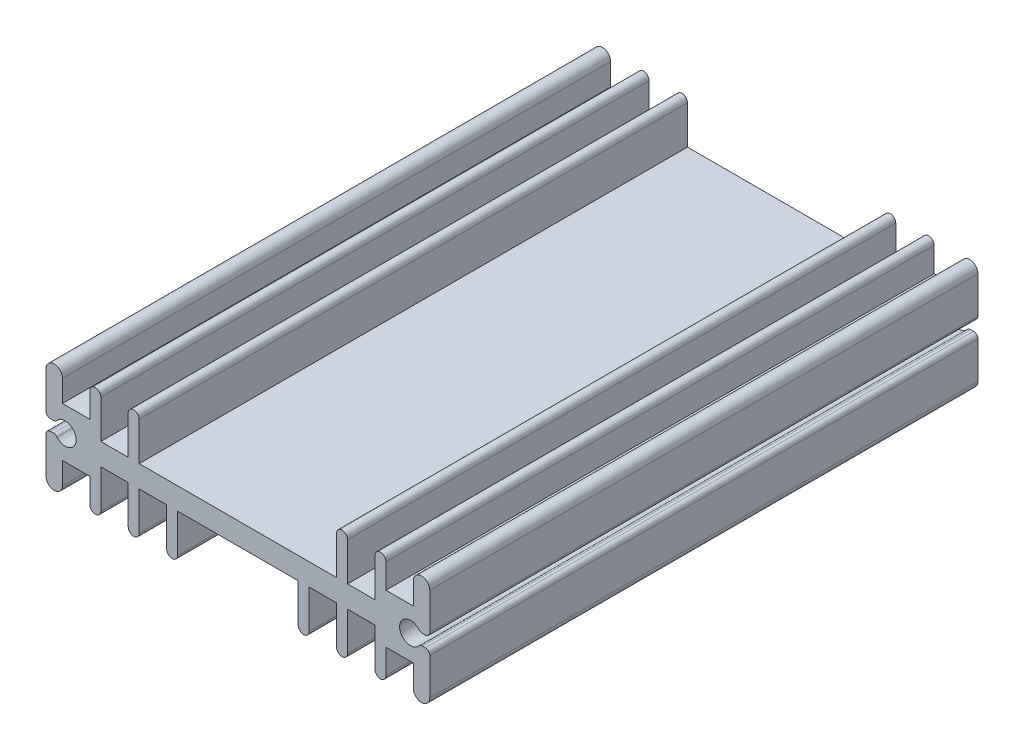
from build123d import *

# Parameters (mm, degrees)
EXTRUDE_1_DEPTH = 50
FILLET_1_R      = 0.4


with BuildPart() as part:
    # Эскиз1 → Бобышка-Вытянуть1 (new body)
    with BuildSketch(Plane.XY):
        with BuildLine():
            Line((17.5, -4.25), (17.5, -0.5))
            Line((17.5, -0.5), (16.616025404, -0.5))
            ThreePointArc((16.616025404, -0.5), (14.75, 0), (16.616025404, 0.5))
            Line((16.616025404, 0.5), (17.5, 0.5))
            Line((17.5, 0.5), (17.5, 4.25))
            ThreePointArc((17.5, 4.25), (16.75, 5), (16, 4.25))
            Line((16, 4.25), (16, 2.25))
            Line((16, 2.25), (13.5, 2.25))
            Line((13.5, 2.25), (13.5, 4.5))
            ThreePointArc((13.5, 4.5), (13, 5), (12.5, 4.5))
            Line((12.5, 4.5), (12.5, 1))
            Line((12.5, 1), (10, 1))
            Line((10, 1), (10, 4.5))
            ThreePointArc((10, 4.5), (9.5, 5), (9, 4.5))
            Line((9, 4.5), (9, 1))
            Line((9, 1), (-9, 1))
            Line((-9, 1), (-9, 4.5))
            ThreePointArc((-9, 4.5), (-9.5, 5), (-10, 4.5))
            Line((-10, 4.5), (-10, 1))
            Line((-10, 1), (-12.5, 1))
            Line((-12.5, 1), (-12.5, 4.5))
            ThreePointArc((-12.5, 4.5), (-13, 5), (-13.5, 4.5))
            Line((-13.5, 4.5), (-13.5, 2.25))
            Line((-13.5, 2.25), (-16, 2.25))
            Line((-16, 2.25), (-16, 4.25))
            ThreePointArc((-16, 4.25), (-16.75, 5), (-17.5, 4.25))
            Line((-17.5, 4.25), (-17.5, 0.5))
            Line((-17.5, 0.5), (-16.616025404, 0.5))
            ThreePointArc((-16.616025404, 0.5), (-14.75, 0), (-16.616025404, -0.5))
            Line((-16.616025404, -0.5), (-17.5, -0.5))
            Line((-17.5, -0.5), (-17.5, -4.25))
            ThreePointArc((-17.5, -4.25), (-16.75, -5), (-16, -4.25))
            Line((-16, -4.25), (-16, -2.25))
            Line((-16, -2.25), (-13.5, -2.25))
            Line((-13.5, -2.25), (-13.5, -4.5))
            ThreePointArc((-13.5, -4.5), (-13, -5), (-12.5, -4.5))
            Line((-12.5, -4.5), (-12.5, -1))
            Line((-12.5, -1), (-10, -1))
            Line((-10, -1), (-10, -4.5))
            ThreePointArc((-10, -4.5), (-9.5, -5), (-9, -4.5))
            Line((-9, -4.5), (-9, -1))
            Line((-9, -1), (-6.5, -1))
            Line((-6.5, -1), (-6.5, -4.5))
            ThreePointArc((-6.5, -4.5), (-6, -5), (-5.5, -4.5))
            Line((-5.5, -4.5), (-5.5, -1))
            Line((-5.5, -1), (5.5, -1))
            Line((5.5, -1), (5.5, -4.5))
            ThreePointArc((5.5, -4.5), (6, -5), (6.5, -4.5))
            Line((6.5, -4.5), (6.5, -1))
            Line((6.5, -1), (9, -1))
            Line((9, -1), (9, -4.5))
            ThreePointArc((9, -4.5), (9.5, -5), (10, -4.5))
            Line((10, -4.5), (10, -1))
            Line((10, -1), (12.5, -1))
            Line((12.5, -1), (12.5, -4.5))
            ThreePointArc((12.5, -4.5), (13, -5), (13.5, -4.5))
            Line((13.5, -4.5), (13.5, -2.25))
            Line((13.5, -2.25), (16, -2.25))
            Line((16, -2.25), (16, -4.25))
            ThreePointArc((16, -4.25), (16.75, -5), (17.5, -4.25))
        make_face()
    extrude(amount=EXTRUDE_1_DEPTH)

    # Скругление1
    fillet_1_edges = [part.edges().sort_by_distance(p)[0] for p in [
        (-17.5, -0.5, 25),
        (-16.616025404, -0.5, 25),
        (-16.616025404, 0.5, 25),
        (-17.5, 0.5, 25),
        (17.5, 0.5, 25),
        (16.616025404, 0.5, 25),
        (16.616025404, -0.5, 25),
        (17.5, -0.5, 25),
    ]]
    fillet(fillet_1_edges, radius=FILLET_1_R)


solid = part.part
